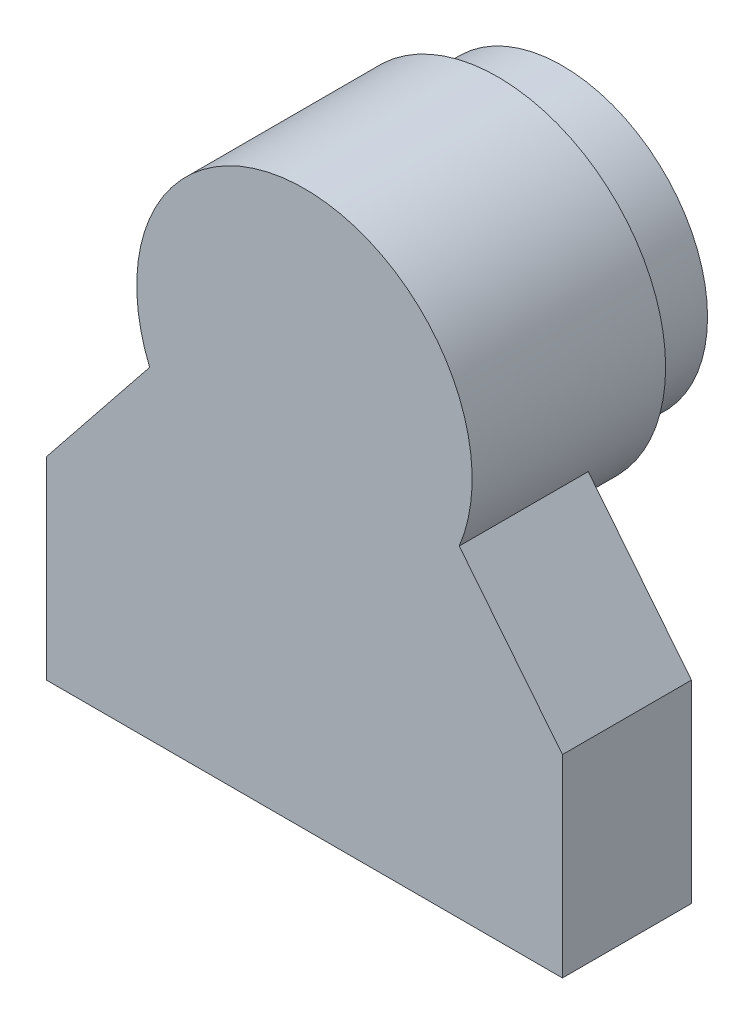
from build123d import *

# Parameters (mm, degrees)
CROQUIS1_R              = 22.5
SALIENTE_EXTRUIR1_DEPTH = 10
CROQUIS2_R              = 26
SALIENTE_EXTRUIR2_DEPTH = 30
SALIENTE_EXTRUIR4_START = -20
SALIENTE_EXTRUIR4_DEPTH = 20
CROQUIS5_R              = 2.5
CORTAR_EXTRUIR1_DEPTH   = 10


with BuildPart() as part:
    # Croquis1 → Saliente-Extruir1 (new body)
    with BuildSketch(Plane.XY):
        Circle(CROQUIS1_R)
    extrude(amount=-SALIENTE_EXTRUIR1_DEPTH)

    # Croquis2 → Saliente-Extruir2 (add)
    with BuildSketch(Plane.XY):
        Circle(CROQUIS2_R)
    extrude(amount=SALIENTE_EXTRUIR2_DEPTH)

    # Croquis3 → Saliente-Extruir4 (add)
    with BuildSketch(Plane.XY.offset(30).offset(SALIENTE_EXTRUIR4_START)):
        with BuildLine():
            Line((-24, -10), (-40, -30))
            Line((-40, -30), (-40, -60))
            Line((-40, -60), (40, -60))
            Line((40, -60), (40, -30))
            Line((40, -30), (24, -10))
            ThreePointArc((24, -10), (0, -26), (-24, -10))
        make_face()
    extrude(amount=SALIENTE_EXTRUIR4_DEPTH)

    # Croquis5 → Cortar-Extruir1 (cut)
    with BuildSketch(Plane.XZ.offset(60)):
        with Locations((-30, 20)):
            Circle(CROQUIS5_R)
        with Locations((30, 20)):
            Circle(CROQUIS5_R)
        with Locations((0, 20)):
            Circle(CROQUIS5_R)
    extrude(amount=-CORTAR_EXTRUIR1_DEPTH, mode=Mode.SUBTRACT)


solid = part.part
